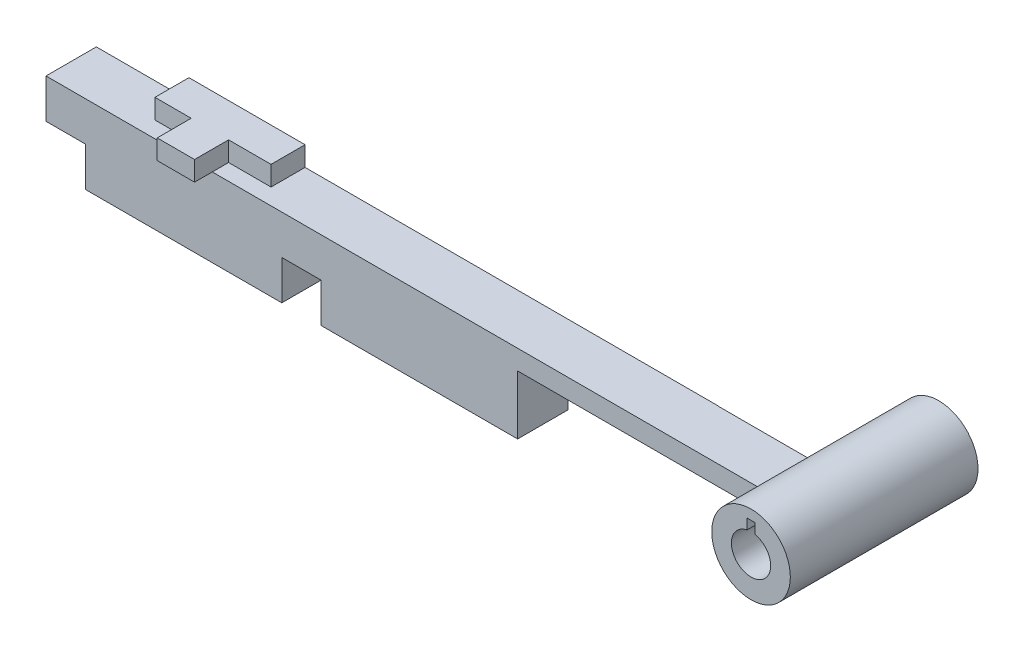
from build123d import *

# Parameters (mm, degrees)
SKETCH1_W                 = 14
SKETCH1_H                 = 10
BOSS_EXTRUDE1_DEPTH       = 5
SKETCH2_W                 = 1.137458902
SKETCH2_H                 = 1.700915576
SKETCH2_W_2               = 1
SKETCH2_H_2               = 2
BOSS_EXTRUDE2_DEPTH       = 3
SKETCH3_W                 = 14
SKETCH3_H                 = 10
CUT_EXTRUDE1_DEPTH        = 3
BOSS_EXTRUDE3_DEPTH       = 9
SKETCH6_W                 = 10
SKETCH6_H                 = 2
BOSS_EXTRUDE4_DEPTH       = 43
BOSS_EXTRUDE5_DEPTH       = 23
BOSS_EXTRUDE5_DEPTH_BACK  = 14
SKETCH7_R                 = 5
SKETCH8_W                 = 10
SKETCH8_H                 = 3
BOSS_EXTRUDE6_DEPTH       = 9
SKETCH9_W                 = 1.004791017
SKETCH9_H                 = 1.799084424
SKETCH9_W_2               = 0.997604491
SKETCH9_W_3               = 1.997604492
SKETCH9_H_2               = 1.5
BOSS_EXTRUDE7_DEPTH       = 3
SKETCH10_W                = 1.001197754
SKETCH10_H                = 2.999195309
CUT_EXTRUDE2_DEPTH        = 3
CUT_EXTRUDE3_DEPTH        = 43
SKETCH12_W                = 2.137458902
SKETCH12_H                = 2
SKETCH12_W_2              = 1
SKETCH12_H_2              = 1.700915576
SKETCH12_W_3              = 0.862541098
SKETCH12_W_4              = 1.997604492
SKETCH12_H_3              = 1.5
SKETCH12_H_4              = 3
SKETCH12_W_5              = 1.001197754
CUT_EXTRUDE4_DEPTH        = 4
SKETCH14_W                = 28.101020514
SKETCH14_H                = 7
CUT_EXTRUDE6_DEPTH        = 4
SKETCH15_W                = 1.997604492
SKETCH15_H                = 1.337298545
SKETCH15_W_2              = 2.137458902
SKETCH15_H_2              = 1.038214121
BOSS_EXTRUDE8_DEPTH       = 1
SKETCH16_W                = 2.161329906
SKETCH16_H                = 1.731474724
SKETCH16_W_2              = 1.90188885
SKETCH16_H_2              = 1.406872125
SKETCH16_H_3              = 0.901189682
SKETCH16_W_3              = 1.846086898
SKETCH16_H_4              = 0.829910231
SKETCH16_H_5              = 0.438615045
BOSS_EXTRUDE9_DEPTH       = 1
SKETCH17_W                = 28.101020514
SKETCH17_H                = 3
CUT_EXTRUDE7_DEPTH        = 1
CUT_EXTRUDE8_START        = -7
SKETCH18_R                = 5
CUT_EXTRUDE8_DEPTH        = 7
SKETCH19_R                = 5
CUT_EXTRUDE9_DEPTH        = 8
CUT_EXTRUDE10_START       = -31
SKETCH20_R                = 5
CUT_EXTRUDE10_DEPTH       = 31
SKETCH21_W                = 17.497056098
SKETCH21_H                = 3
CUT_EXTRUDE11_DEPTH       = 31
SKETCH22_W                = 10
SKETCH22_H                = 3
CUT_EXTRUDE12_DEPTH       = 7
SKETCH23_W                = 1.90188885
SKETCH23_H                = 1.406872125
CUT_EXTRUDE13_DEPTH       = 2
BOSS_EXTRUDE10_DEPTH      = 10
BOSS_EXTRUDE10_DEPTH_BACK = 6
SKETCH24_R                = 3
CUT_EXTRUDE14_DEPTH       = 16
CUT_EXTRUDE18_START       = -10
SKETCH26_R                = 3
SKETCH26_R_2              = 2.5
CUT_EXTRUDE18_DEPTH       = 10
SKETCH27_R                = 3
CUT_EXTRUDE19_DEPTH       = 3
CUT_EXTRUDE20_START       = -4
SKETCH28_R                = 2.5
CUT_EXTRUDE20_DEPTH       = 4
CUT_EXTRUDE22_DEPTH       = 2
CUT_EXTRUDE22_DEPTH_BACK  = 7
SKETCH29_W                = 4.063218756
SKETCH29_H                = 0.438615045
SKETCH29_W_2              = 21.023429879
CUT_EXTRUDE23_START       = -10
SKETCH30_R                = 3
CUT_EXTRUDE23_DEPTH       = 10
BOSS_EXTRUDE11_START      = -2.55
BOSS_EXTRUDE11_DEPTH      = 2.55
BOSS_EXTRUDE12_DEPTH      = 7.55
BOSS_EXTRUDE12_DEPTH_BACK = 6
CUT_EXTRUDE24_DEPTH       = 13.55
BOSS_EXTRUDE13_DEPTH      = 2.55
BOSS_EXTRUDE14_DEPTH      = 6.55
BOSS_EXTRUDE14_DEPTH_BACK = 4
SKETCH35_R                = 2
CUT_EXTRUDE25_START       = -14.55
SKETCH36_R                = 2
CUT_EXTRUDE25_DEPTH       = 14.55
BOSS_EXTRUDE15_DEPTH      = 2.55
SKETCH38_R                = 1
CUT_EXTRUDE26_DEPTH       = 16.55
SKETCH39_R                = 2
CUT_EXTRUDE27_DEPTH       = 10.55
BOSS_EXTRUDE16_DEPTH      = 2.55
BOSS_EXTRUDE17_DEPTH      = 5.55
BOSS_EXTRUDE17_DEPTH_BACK = 4
SKETCH41_R                = 2
SKETCH42_R                = 1
CUT_EXTRUDE28_DEPTH       = 13.55


with BuildPart() as part:
    # Sketch1 → Boss-Extrude1 (new body)
    with BuildSketch(Plane(origin=(0, 0, 0), x_dir=(1, 0, 0), z_dir=(0, 1, 0))):
        with Locations((7, 5)):
            Rectangle(SKETCH1_W, SKETCH1_H)
    extrude(amount=BOSS_EXTRUDE1_DEPTH)

    # Sketch2 → Boss-Extrude2 (add)
    with BuildSketch(Plane(origin=(0, 5, 0), x_dir=(1, 0, 0), z_dir=(0, 1, 0))):
        with Locations((7.568729451, 6.812243667)):
            Rectangle(SKETCH2_W, SKETCH2_H)
        with Locations((6.5, 6.812243667)):
            Rectangle(SKETCH2_W_2, SKETCH2_H)
        Polygon((7, 5), (7, 5.961785879), (6, 5.961785879), (5, 5.961785879), (5, 5), align=None)
        Polygon((7, 3.961785879), (7, 5), (5, 5), (5, 3.961785879), (6, 3.961785879), align=None)
        Polygon((8.137458902, 5.961785879), (7, 5.961785879), (7, 5), (9, 5), (9, 5.961785879), align=None)
        Polygon((9, 5), (7, 5), (7, 3.961785879), (8.137458902, 3.961785879), (9, 3.961785879), align=None)
        with Locations((6.5, 2.961785879)):
            Rectangle(SKETCH2_W_2, SKETCH2_H_2)
        with Locations((7.568729451, 2.961785879)):
            Rectangle(SKETCH2_W, SKETCH2_H_2)
    extrude(amount=BOSS_EXTRUDE2_DEPTH)

    # Sketch3 → Cut-Extrude1 (cut)
    with BuildSketch(Plane.XZ):
        with Locations((7, -5)):
            Rectangle(SKETCH3_W, SKETCH3_H)
    extrude(amount=-CUT_EXTRUDE1_DEPTH, mode=Mode.SUBTRACT)

    # Sketch5 → Boss-Extrude3 (add)
    with BuildSketch(Plane.XZ.offset(-3)):
        Polygon((12, 0), (7, 0), (2, 0), (2, -3), (12, -3), align=None)
    extrude(amount=BOSS_EXTRUDE3_DEPTH)

    # Sketch6 → Boss-Extrude4 (add)
    with BuildSketch(Plane(origin=(14, 0, 0), x_dir=(0, 0, -1), z_dir=(1, 0, 0))):
        with Locations((5, 4)):
            Rectangle(SKETCH6_W, SKETCH6_H)
    extrude(amount=BOSS_EXTRUDE4_DEPTH)

    # Sketch7 → Boss-Extrude5 (add, two sides: drawn at the far end of the back side and taken through both)
    with BuildSketch(Plane.XY.offset(-BOSS_EXTRUDE5_DEPTH_BACK)):
        with Locations((57, 4)):
            Circle(SKETCH7_R)
    extrude(amount=BOSS_EXTRUDE5_DEPTH + BOSS_EXTRUDE5_DEPTH_BACK)

    # Sketch8 → Boss-Extrude6 (add)
    with BuildSketch(Plane(origin=(0, 3, 0), x_dir=(-1, 0, 0), z_dir=(0, -1, 0))):
        with Locations((-19, 1.5)):
            Rectangle(SKETCH8_W, SKETCH8_H)
    extrude(amount=BOSS_EXTRUDE6_DEPTH)

    # Sketch9 → Boss-Extrude7 (add)
    with BuildSketch(Plane(origin=(0, 5, 0), x_dir=(1, 0, 0), z_dir=(0, 1, 0))):
        Polygon((17.004791017, 6.161896764), (17.004791017, 5.457884441), (18.002395508, 5.20983516), (18.002395508, 6.161896764), align=None)
        Polygon((16, 6.161896764), (16, 5.707720615), (17.004791017, 5.457884441), (17.004791017, 6.161896764), (16.100648674, 6.161896764), align=None)
        Polygon((16, 5.707720615), (16, 4.961785879), (17.004791017, 4.961785879), (17.004791017, 5.457884441), align=None)
        Polygon((17.004791017, 5.457884441), (17.004791017, 4.961785879), (18.002395508, 4.961785879), (18.002395508, 5.20983516), align=None)
        with Locations((16.502395509, 4.062243667)):
            Rectangle(SKETCH9_W, SKETCH9_H)
        with Locations((17.503593263, 4.062243667)):
            Rectangle(SKETCH9_W_2, SKETCH9_H)
        Polygon((18.002395508, 5.20983516), (18.002395508, 4.961785879), (19, 4.961785879), align=None)
        Polygon((19, 4.961785879), (18.002395508, 4.961785879), (18.002395508, 3.162701455), (20, 3.162701455), (20, 4.662701455), (20, 6.162701455), (20, 7.662701455), (19, 7.662701455), (18.002395508, 7.662701455), (18.002395508, 6.161896764), (18.002395508, 5.20983516), align=None)
        Polygon((20, 4.662701455), (20, 3.162701455), (21, 3.162701455), (21, 6.162701455), (20, 6.162701455), align=None)
        with Locations((19.001197754, 2.412701455)):
            Rectangle(SKETCH9_W_3, SKETCH9_H_2)
    extrude(amount=BOSS_EXTRUDE7_DEPTH)

    # Sketch10 → Cut-Extrude2 (cut)
    with BuildSketch(Plane(origin=(0, 8, 0), x_dir=(1, 0, 0), z_dir=(0, 1, 0))):
        with Locations((16.500598877, 4.66229911)):
            Rectangle(SKETCH10_W, SKETCH10_H)
    extrude(amount=-CUT_EXTRUDE2_DEPTH, mode=Mode.SUBTRACT)

    # Sketch11 → Cut-Extrude3 (cut)
    with BuildSketch(Plane.XY.offset(23)):
        with BuildLine():
            Line((56.5, 6.795107369), (56.5, 5.936491673))
            ThreePointArc((56.5, 5.936491673), (56.747991415, 5.984059393), (57, 6))
            Line((57, 6), (57, 6.795107369))
            Line((57, 6.795107369), (56.5, 6.795107369))
        make_face()
        with BuildLine():
            ThreePointArc((57, 6), (57.252008585, 5.984059393), (57.5, 5.936491673))
            Line((57.5, 5.936491673), (57.5, 6.795107369))
            Line((57.5, 6.795107369), (57, 6.795107369))
            Line((57, 6.795107369), (57, 6))
        make_face()
        with BuildLine():
            ThreePointArc((56.5, 5.936491673), (55.41886117, 5.224744871), (55, 4))
            Line((55, 4), (59, 4))
            ThreePointArc((59, 4), (58.58113883, 5.224744871), (57.5, 5.936491673))
            ThreePointArc((57.5, 5.936491673), (57.252008585, 5.984059393), (57, 6))
            ThreePointArc((57, 6), (56.747991415, 5.984059393), (56.5, 5.936491673))
        make_face()
        with BuildLine():
            Line((59, 4), (55, 4))
            ThreePointArc((55, 4), (57, 2), (59, 4))
        make_face()
    extrude(amount=-CUT_EXTRUDE3_DEPTH, mode=Mode.SUBTRACT)

    # Sketch12 → Cut-Extrude4 (cut)
    with BuildSketch(Plane(origin=(0, 8, 0), x_dir=(1, 0, 0), z_dir=(0, 1, 0))):
        with Locations((7.068729451, 2.961785879)):
            Rectangle(SKETCH12_W, SKETCH12_H)
        with Locations((7.068729451, 4.961785879)):
            Rectangle(SKETCH12_W, SKETCH12_H)
        with Locations((5.5, 4.961785879)):
            Rectangle(SKETCH12_W_2, SKETCH12_H)
        with Locations((7.068729451, 6.812243667)):
            Rectangle(SKETCH12_W, SKETCH12_H_2)
        with Locations((8.568729451, 4.961785879)):
            Rectangle(SKETCH12_W_3, SKETCH12_H)
        with Locations((19.001197754, 2.412701455)):
            Rectangle(SKETCH12_W_4, SKETCH12_H_3)
        with Locations((19.001197754, 4.662701455)):
            Rectangle(SKETCH12_W_4, SKETCH12_H_4)
        with Locations((20.5, 4.662701455)):
            Rectangle(SKETCH12_W_2, SKETCH12_H_4)
        with Locations((19.001197754, 6.912701455)):
            Rectangle(SKETCH12_W_4, SKETCH12_H_3)
        with Locations((17.501796631, 4.662701455)):
            Rectangle(SKETCH12_W_5, SKETCH12_H_4)
    extrude(amount=-CUT_EXTRUDE4_DEPTH, mode=Mode.SUBTRACT)

    # Sketch14 → Cut-Extrude6 (cut)
    with BuildSketch(Plane.XZ.offset(-3)):
        Polygon((0, -3), (0, -10), (24, -10), (24, -3), (14, -3), (12, -3), (2, -3), align=None)
        with Locations((38.050510257, -6.5)):
            Rectangle(SKETCH14_W, SKETCH14_H)
    extrude(amount=-CUT_EXTRUDE6_DEPTH, mode=Mode.SUBTRACT)

    # Sketch15 → Boss-Extrude8 (add)
    with BuildSketch(Plane(origin=(0, 4, 0), x_dir=(1, 0, 0), z_dir=(0, 1, 0))):
        with Locations((19.001197754, 2.331350728)):
            Rectangle(SKETCH15_W, SKETCH15_H)
        with Locations((7.068729451, 2.48089294)):
            Rectangle(SKETCH15_W_2, SKETCH15_H_2)
    extrude(amount=BOSS_EXTRUDE8_DEPTH)

    # Sketch16 → Boss-Extrude9 (add)
    with BuildSketch(Plane(origin=(0, 5, 0), x_dir=(1, 0, 0), z_dir=(0, 1, 0))):
        with Locations((9.541829693, 1.695647593)):
            Rectangle(SKETCH16_W, SKETCH16_H)
        with Locations((7.510220315, 1.695647593)):
            Rectangle(SKETCH16_W_2, SKETCH16_H)
        with Locations((7.510220315, 3.703436063)):
            Rectangle(SKETCH16_W_2, SKETCH16_H_2)
        with Locations((7.510220315, -0.450594841)):
            Rectangle(SKETCH16_W_2, SKETCH16_H_3)
        with Locations((5.636232441, 1.695647593)):
            Rectangle(SKETCH16_W_3, SKETCH16_H)
        with Locations((7.510220315, 0.414955116)):
            Rectangle(SKETCH16_W_2, SKETCH16_H_4)
        with Locations((7.510220315, 2.780692478)):
            Rectangle(SKETCH16_W_2, SKETCH16_H_5)
    extrude(amount=BOSS_EXTRUDE9_DEPTH)

    # Sketch17 → Cut-Extrude7 (cut)
    with BuildSketch(Plane.XZ.offset(-3)):
        with Locations((38.050510257, -1.5)):
            Rectangle(SKETCH17_W, SKETCH17_H)
    extrude(amount=-CUT_EXTRUDE7_DEPTH, mode=Mode.SUBTRACT)

    # Sketch18 → Cut-Extrude8 (cut)
    with BuildSketch(Plane.XY.offset(23).offset(CUT_EXTRUDE8_START)):
        with Locations((57, 4)):
            Circle(SKETCH18_R)
    extrude(amount=CUT_EXTRUDE8_DEPTH, mode=Mode.SUBTRACT)

    # Sketch19 → Cut-Extrude9 (cut)
    with BuildSketch(Plane(origin=(0, 0, -14), x_dir=(-1, 0, 0), z_dir=(0, 0, -1))):
        with Locations((-57, 4)):
            Circle(SKETCH19_R)
    extrude(amount=-CUT_EXTRUDE9_DEPTH, mode=Mode.SUBTRACT)

    # Sketch20 → Cut-Extrude10 (cut)
    with BuildSketch(Plane.XY.offset(16).offset(CUT_EXTRUDE10_START)):
        with Locations((57, 4)):
            Circle(SKETCH20_R)
    extrude(amount=CUT_EXTRUDE10_DEPTH, mode=Mode.SUBTRACT)

    # Sketch21 → Cut-Extrude11 (cut)
    with BuildSketch(Plane(origin=(0, 5, 0), x_dir=(1, 0, 0), z_dir=(0, 1, 0))):
        with Locations((43.352492465, 1.5)):
            Rectangle(SKETCH21_W, SKETCH21_H)
    extrude(amount=-CUT_EXTRUDE11_DEPTH, mode=Mode.SUBTRACT)

    # Sketch22 → Cut-Extrude12 (cut)
    with BuildSketch(Plane.XZ.offset(6)):
        with Locations((7, -1.5)):
            Rectangle(SKETCH22_W, SKETCH22_H)
        with Locations((19, -1.5)):
            Rectangle(SKETCH22_W, SKETCH22_H)
    extrude(amount=-CUT_EXTRUDE12_DEPTH, mode=Mode.SUBTRACT)

    # Sketch23 → Cut-Extrude13 (cut)
    with BuildSketch(Plane(origin=(0, 6, 0), x_dir=(1, 0, 0), z_dir=(0, 1, 0))):
        with Locations((7.510220315, 3.703436063)):
            Rectangle(SKETCH23_W, SKETCH23_H)
    extrude(amount=-CUT_EXTRUDE13_DEPTH, mode=Mode.SUBTRACT)

    # Sketch24 → Boss-Extrude10 (add, two sides: drawn at the far end of the back side and taken through both)
    with BuildSketch(Plane.XY.offset(-BOSS_EXTRUDE10_DEPTH_BACK)):
        with Locations((34.603964416, 4.5)):
            Circle(SKETCH24_R)
    extrude(amount=BOSS_EXTRUDE10_DEPTH + BOSS_EXTRUDE10_DEPTH_BACK)

    # Sketch25 → Cut-Extrude14 (cut)
    with BuildSketch(Plane.XY.offset(10)):
        with BuildLine():
            ThreePointArc((34.403964416, 5.479795897), (33.829367747, 5.132455532), (33.603964416, 4.5))
            Line((33.603964416, 4.5), (35.603964416, 4.5))
            ThreePointArc((35.603964416, 4.5), (35.378561086, 5.132455532), (34.803964416, 5.479795897))
            ThreePointArc((34.803964416, 5.479795897), (34.704473378, 5.494936153), (34.603964416, 5.5))
            ThreePointArc((34.603964416, 5.5), (34.503455454, 5.494936153), (34.403964416, 5.479795897))
        make_face()
        with BuildLine():
            Line((35.603964416, 4.5), (33.603964416, 4.5))
            ThreePointArc((33.603964416, 4.5), (34.603964416, 3.5), (35.603964416, 4.5))
        make_face()
        Polygon((34.803964416, 5.479795897), (34.603964416, 6), (34.803964416, 6), align=None)
        with BuildLine():
            ThreePointArc((34.603964416, 5.5), (34.704473378, 5.494936153), (34.803964416, 5.479795897))
            Line((34.803964416, 5.479795897), (34.603964416, 6))
            Line((34.603964416, 6), (34.603964416, 5.5))
        make_face()
        with BuildLine():
            Line((34.403964416, 6), (34.403964416, 5.479795897))
            ThreePointArc((34.403964416, 5.479795897), (34.503455454, 5.494936153), (34.603964416, 5.5))
            Line((34.603964416, 5.5), (34.603964416, 6))
            Line((34.603964416, 6), (34.403964416, 6))
        make_face()
    extrude(amount=-CUT_EXTRUDE14_DEPTH, mode=Mode.SUBTRACT)

    # Sketch26 → Cut-Extrude18 (cut)
    with BuildSketch(Plane.XY.offset(10).offset(CUT_EXTRUDE18_START)):
        with Locations((34.603964416, 4.5)):
            Circle(SKETCH26_R)
        with Locations((34.603964416, 4.5)):
            Circle(SKETCH26_R_2, mode=Mode.SUBTRACT)
    extrude(amount=CUT_EXTRUDE18_DEPTH, mode=Mode.SUBTRACT)

    # Sketch27 → Cut-Extrude19 (cut)
    with BuildSketch(Plane(origin=(0, 0, -6), x_dir=(-1, 0, 0), z_dir=(0, 0, -1))):
        with Locations((-34.603964416, 4.5)):
            Circle(SKETCH27_R)
    extrude(amount=-CUT_EXTRUDE19_DEPTH, mode=Mode.SUBTRACT)

    # Sketch28 → Cut-Extrude20 (cut)
    with BuildSketch(Plane.XY.offset(10).offset(CUT_EXTRUDE20_START)):
        with Locations((34.603964416, 4.5)):
            Circle(SKETCH28_R)
    extrude(amount=CUT_EXTRUDE20_DEPTH, mode=Mode.SUBTRACT)

    # Sketch29 → Cut-Extrude22 (cut, two sides: drawn at the far end of the back side and taken through both)
    with BuildSketch(Plane(origin=(0, 5, 0), x_dir=(1, 0, 0), z_dir=(0, 1, 0)).offset(-CUT_EXTRUDE22_DEPTH_BACK)):
        Polygon((6.55927589, 3), (0, 3), (0, 2.561384955), (4.713188992, 2.561384955), (6.55927589, 2.561384955), align=None)
        with Locations((8.590885268, 2.780692478)):
            Rectangle(SKETCH29_W, SKETCH29_H)
        with Locations((21.134209586, 2.780692478)):
            Rectangle(SKETCH29_W_2, SKETCH29_H)
    extrude(amount=CUT_EXTRUDE22_DEPTH + CUT_EXTRUDE22_DEPTH_BACK, mode=Mode.SUBTRACT)

    # Sketch30 → Cut-Extrude23 (cut)
    with BuildSketch(Plane.XY.offset(6).offset(CUT_EXTRUDE23_START)):
        with Locations((34.603964416, 4.5)):
            Circle(SKETCH30_R)
    extrude(amount=CUT_EXTRUDE23_DEPTH, mode=Mode.SUBTRACT)

    # Sketch31 → Boss-Extrude11 (add)
    with BuildSketch(Plane.XY.offset(BOSS_EXTRUDE11_START)):
        with BuildLine():
            ThreePointArc((31.645924525, 5), (31.603964416, 4.5), (31.645924525, 4))
            Line((31.645924525, 4), (37.467734395, 4))
            Line((37.467734395, 4), (37.467734395, 5))
            Line((37.467734395, 5), (31.645924525, 5))
        make_face()
    extrude(amount=BOSS_EXTRUDE11_DEPTH)

    # Sketch32 → Boss-Extrude12 (add, two sides: drawn at the far end of the back side and taken through both)
    with BuildSketch(Plane.XY.offset(-BOSS_EXTRUDE12_DEPTH_BACK)):
        with BuildLine():
            ThreePointArc((36.037292469, 5), (34.100800796, 6.5), (32.164309123, 5))
            Line((32.164309123, 5), (34.100800796, 5))
            Line((34.100800796, 5), (36.037292469, 5))
        make_face()
        with BuildLine():
            ThreePointArc((32.164309123, 5), (32.100800796, 4.5), (32.164309123, 4))
            Line((32.164309123, 4), (34.100800796, 4))
            Line((34.100800796, 4), (34.100800796, 5))
            Line((34.100800796, 5), (32.164309123, 5))
        make_face()
        with BuildLine():
            Line((34.100800796, 5), (34.100800796, 4))
            Line((34.100800796, 4), (36.037292469, 4))
            ThreePointArc((36.037292469, 4), (36.084860189, 4.247991415), (36.100800796, 4.5))
            ThreePointArc((36.100800796, 4.5), (36.084860189, 4.752008585), (36.037292469, 5))
            Line((36.037292469, 5), (34.100800796, 5))
        make_face()
        with BuildLine():
            Line((34.100800796, 4), (32.164309123, 4))
            ThreePointArc((32.164309123, 4), (34.100800796, 2.5), (36.037292469, 4))
            Line((36.037292469, 4), (34.100800796, 4))
        make_face()
    extrude(amount=BOSS_EXTRUDE12_DEPTH + BOSS_EXTRUDE12_DEPTH_BACK)

    # Sketch33 → Cut-Extrude24 (cut)
    with BuildSketch(Plane.XY.offset(7.55)):
        with BuildLine():
            ThreePointArc((33.900800796, 5.479795897), (33.326204127, 5.132455532), (33.100800796, 4.5))
            Line((33.100800796, 4.5), (35.100800796, 4.5))
            ThreePointArc((35.100800796, 4.5), (34.875397465, 5.132455532), (34.300800796, 5.479795897))
            ThreePointArc((34.300800796, 5.479795897), (34.201309758, 5.494936153), (34.100800796, 5.5))
            ThreePointArc((34.100800796, 5.5), (34.000291834, 5.494936153), (33.900800796, 5.479795897))
        make_face()
        with BuildLine():
            Line((35.100800796, 4.5), (33.100800796, 4.5))
            ThreePointArc((33.100800796, 4.5), (34.100800796, 3.5), (35.100800796, 4.5))
        make_face()
        with BuildLine():
            ThreePointArc((34.100800796, 5.5), (34.201309758, 5.494936153), (34.300800796, 5.479795897))
            Line((34.300800796, 5.479795897), (34.100800796, 6))
            Line((34.100800796, 6), (34.100800796, 5.5))
        make_face()
        Polygon((34.300800796, 5.479795897), (34.100800796, 6), (34.300800796, 6), align=None)
        with BuildLine():
            Line((33.900800796, 6), (33.900800796, 5.479795897))
            ThreePointArc((33.900800796, 5.479795897), (34.000291834, 5.494936153), (34.100800796, 5.5))
            Line((34.100800796, 5.5), (34.100800796, 6))
            Line((34.100800796, 6), (33.900800796, 6))
        make_face()
    extrude(amount=-CUT_EXTRUDE24_DEPTH, mode=Mode.SUBTRACT)

    # Sketch34 → Boss-Extrude13 (add)
    with BuildSketch(Plane.XY):
        with BuildLine():
            ThreePointArc((37.467734395, 4), (38.803514189, 4.285550514), (39.967734395, 5))
            Line((39.967734395, 5), (37.467734395, 5))
            Line((37.467734395, 5), (37.467734395, 4))
        make_face()
        with BuildLine():
            ThreePointArc((37.467734395, 5), (38.293118446, 5.395747071), (39.0169964, 5.955992807))
            Line((39.0169964, 5.955992807), (39.967734395, 5))
            Line((39.967734395, 5), (37.467734395, 5))
        make_face()
        Polygon((39.967734395, 5), (41.817668177, 6.83976524), (39.0169964, 5.955992807), align=None)
        Polygon((40.892701286, 7.769844503), (41.817668177, 6.83976524), (39.0169964, 5.955992807), align=None)
    extrude(amount=-BOSS_EXTRUDE13_DEPTH)

    # Sketch35 → Boss-Extrude14 (add, two sides: drawn at the far end of the back side and taken through both)
    with BuildSketch(Plane.XY.offset(-BOSS_EXTRUDE14_DEPTH_BACK)):
        with Locations((41.355184732, 7.304804872)):
            Circle(SKETCH35_R)
    extrude(amount=BOSS_EXTRUDE14_DEPTH + BOSS_EXTRUDE14_DEPTH_BACK)

    # Sketch36 → Cut-Extrude25 (cut)
    with BuildSketch(Plane.XY.offset(7.55).offset(CUT_EXTRUDE25_START)):
        with Locations((34.100800796, 4.5)):
            Circle(SKETCH36_R)
    extrude(amount=CUT_EXTRUDE25_DEPTH, mode=Mode.SUBTRACT)


with BuildPart() as cut_extrude25_piece_1:
    # of the separate pieces the step leaves, piece 1, a body of its own (cut_extrude25_pieces)
    add(part.part.solids().sort_by_distance((12, 3, 0))[0])



with BuildPart() as cut_extrude25_piece_2:
    # of the separate pieces the step leaves, piece 2, a body of its own (cut_extrude25_pieces)
    add(part.part.solids().sort_by_distance((36.037292469, 4, 0))[0])


with BuildPart() as cut_extrude25_piece_1_1:
    add(cut_extrude25_piece_1.part)

    add(cut_extrude25_piece_2.part)  # Boss-Extrude15 merges Cut-Extrude25 piece 2
    # Sketch37 → Boss-Extrude15 (add)
    with BuildSketch(Plane.XY):
        with BuildLine():
            ThreePointArc((32.164309123, 5), (32.100800796, 4.5), (32.164309123, 4))
            Line((32.164309123, 4), (37.272107827, 4))
            Line((37.272107827, 4), (37.272107827, 5))
            Line((37.272107827, 5), (32.164309123, 5))
        make_face()
    extrude(amount=-BOSS_EXTRUDE15_DEPTH)

    # Sketch38 → Cut-Extrude26 (cut)
    with BuildSketch(Plane.XY.offset(6.55)):
        with BuildLine():
            Line((41.355184732, 8.304804872), (41.355184732, 8.804804872))
            Line((41.355184732, 8.804804872), (41.155184732, 8.804804872))
            Line((41.155184732, 8.804804872), (41.155184732, 8.284600769))
            ThreePointArc((41.155184732, 8.284600769), (41.25467577, 8.299741025), (41.355184732, 8.304804872))
        make_face()
        with BuildLine():
            Line((41.555184732, 8.804804872), (41.355184732, 8.804804872))
            Line((41.355184732, 8.804804872), (41.355184732, 8.304804872))
            ThreePointArc((41.355184732, 8.304804872), (41.455693694, 8.299741025), (41.555184732, 8.284600769))
            Line((41.555184732, 8.284600769), (41.555184732, 8.804804872))
        make_face()
        with Locations((41.355184732, 7.304804872)):
            Circle(SKETCH38_R)
    extrude(amount=-CUT_EXTRUDE26_DEPTH, mode=Mode.SUBTRACT)

    # Sketch39 → Cut-Extrude27 (cut)
    with BuildSketch(Plane.XY.offset(6.55)):
        with Locations((41.355184732, 7.304804872)):
            Circle(SKETCH39_R)
    extrude(amount=-CUT_EXTRUDE27_DEPTH, mode=Mode.SUBTRACT)

    # Sketch40 → Boss-Extrude16 (add)
    with BuildSketch(Plane.XY):
        with BuildLine():
            Line((40.955285549, 7.877000055), (40.477980987, 5.507441917))
            ThreePointArc((40.477980987, 5.507441917), (39.92726074, 5.904435965), (39.541071987, 6.462786493))
            Line((39.541071987, 6.462786493), (40.955285549, 7.877000055))
        make_face()
        Polygon((40.477980987, 5.507441917), (41.901412338, 6.930873267), (40.955285549, 7.877000055), align=None)
    extrude(amount=-BOSS_EXTRUDE16_DEPTH)

    # Sketch41 → Boss-Extrude17 (add, two sides: drawn at the far end of the back side and taken through both)
    with BuildSketch(Plane.XY.offset(-BOSS_EXTRUDE17_DEPTH_BACK)):
        with Locations((41.428348943, 7.403936661)):
            Circle(SKETCH41_R)
    extrude(amount=BOSS_EXTRUDE17_DEPTH + BOSS_EXTRUDE17_DEPTH_BACK)

    # Sketch42 → Cut-Extrude28 (cut)
    with BuildSketch(Plane.XY.offset(5.55)):
        with Locations((41.428348943, 7.403936661)):
            Circle(SKETCH42_R)
        with BuildLine():
            Line((41.628348943, 8.383732558), (41.428348943, 8.903936661))
            Line((41.428348943, 8.903936661), (41.428348943, 8.403936661))
            ThreePointArc((41.428348943, 8.403936661), (41.528857906, 8.398872814), (41.628348943, 8.383732558))
        make_face()
        Polygon((41.628348943, 8.383732558), (41.428348943, 8.903936661), (41.628348943, 8.903936661), align=None)
        with BuildLine():
            Line((41.428348943, 8.403936661), (41.428348943, 8.903936661))
            Line((41.428348943, 8.903936661), (41.228348943, 8.903936661))
            Line((41.228348943, 8.903936661), (41.228348943, 8.383732558))
            ThreePointArc((41.228348943, 8.383732558), (41.327839981, 8.398872814), (41.428348943, 8.403936661))
        make_face()
    extrude(amount=-CUT_EXTRUDE28_DEPTH, mode=Mode.SUBTRACT)


solid = cut_extrude25_piece_1_1.part
